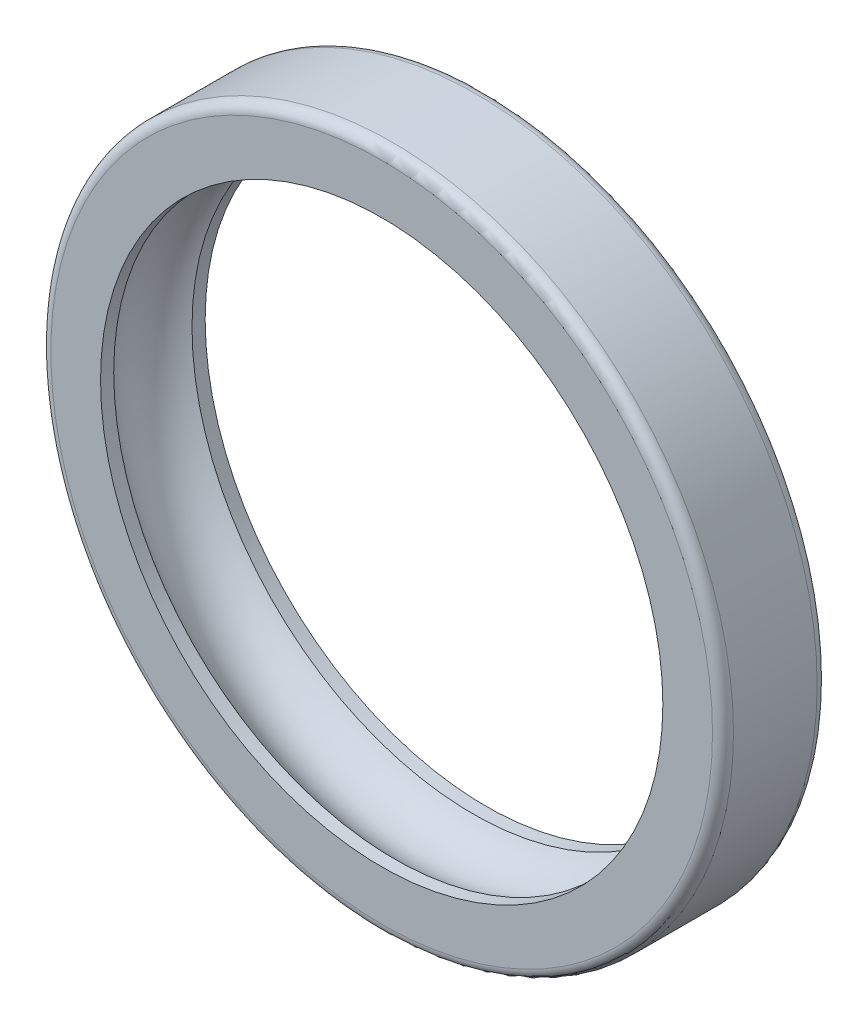
from build123d import *

# Parameters (mm, degrees)
SKETCH_1_R      = 65.25
SKETCH_1_R_2    = 50.25
EXTRUDE_1_DEPTH = 10
FILLET_1_R      = 2


with BuildPart() as part:
    # 草图1 → 凸台-拉伸1 (new, symmetric)
    with BuildSketch(Plane.XY):
        Circle(SKETCH_1_R)
        Circle(SKETCH_1_R_2, mode=Mode.SUBTRACT)
    extrude(amount=EXTRUDE_1_DEPTH, both=True)

    # 草图2 → 切除-旋转2 (revolve, cut)
    with BuildSketch(Plane(origin=(0, 0, 0), x_dir=(1, 0, 0), z_dir=(0, 1, 0)), mode=Mode.PRIVATE) as cut_revolve_2_sk:
        with BuildLine():
            Line((53.75, 10), (53.75, 7.483314774))
            ThreePointArc((53.75, 7.483314774), (57.75, 0), (53.75, -7.483314774))
            Line((53.75, -7.483314774), (53.75, -10))
            Line((53.75, -10), (42.293700596, -10))
            Line((42.293700596, -10), (42.293700596, 10))
            Line((42.293700596, 10), (53.75, 10))
        make_face()
    revolve(cut_revolve_2_sk.sketch.rotate(Axis((0, 0, -25.196328101), (0, 0, 1)), 180), axis=Axis((0, 0, -25.196328101), (0, 0, 1)), mode=Mode.SUBTRACT)

    # 圆角1
    fillet_1_edges = [part.edges().sort_by_distance(p)[0] for p in [
        (-65.25, 0, -10),
        (-65.25, 0, 10),
    ]]
    fillet(fillet_1_edges, radius=FILLET_1_R)


solid = part.part
